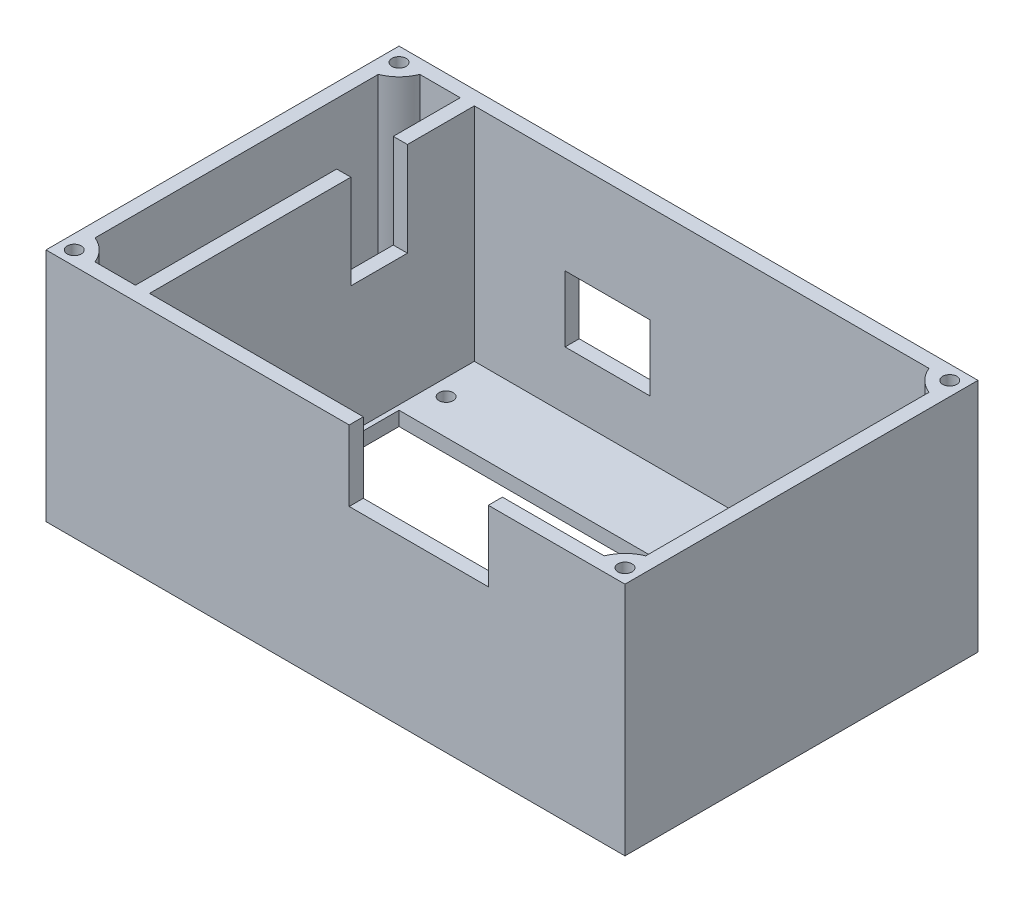
from build123d import *

# Parameters (mm, degrees)
SKETCH_1_R          = 1.5
EXTRUDE_1_DEPTH     = 3
SKETCH_2_W          = 123
SKETCH_2_H          = 75
EXTRUDE_2_DEPTH     = 47
SKETCH_3_W          = 6.652297382
SKETCH_3_H          = 12.01949186
CUT_EXTRUDE_1_DEPTH = 20
EXTRUDE_3_DEPTH     = 47
SKETCH_5_R          = 1.5
CUT_EXTRUDE_2_DEPTH = 10
SKETCH_7_W          = 4
SKETCH_7_H          = 24
EXTRUDE_4_DEPTH     = 8
SKETCH_8_W          = 4
SKETCH_8_H          = 24
EXTRUDE_5_DEPTH     = 10
SKETCH_9_W          = 14
SKETCH_9_H          = 4
EXTRUDE_6_DEPTH     = 8
SKETCH_10_W         = 29.551054495
SKETCH_10_H         = 15
CUT_EXTRUDE_3_DEPTH = 10
SKETCH_11_W         = 18
SKETCH_11_H         = 14
CUT_EXTRUDE_4_DEPTH = 10


with BuildPart() as part:
    # Эскиз1 → Бобышка-Вытянуть1 (new body)
    with BuildSketch(Plane(origin=(0, 0, 0), x_dir=(1, 0, 0), z_dir=(0, 1, 0))):
        Polygon((54, -3.949274275), (54, 40), (-69, 40), (-69, -35), (54, -35), align=None)
        with Locations(Location((-46.5, 27.5, 0), (0, 0, 270))):
            Circle(SKETCH_1_R, mode=Mode.SUBTRACT)
        with Locations(Location((-46.5, -27.5, 0), (0, 0, 270))):
            Circle(SKETCH_1_R, mode=Mode.SUBTRACT)
        with Locations(Location((46.5, 27.5, 0), (0, 0, 270))):
            Circle(SKETCH_1_R, mode=Mode.SUBTRACT)
        with Locations(Location((46.5, -27.5, 0), (0, 0, 270))):
            Circle(SKETCH_1_R, mode=Mode.SUBTRACT)
        Polygon((-49, 20), (-49, -20), (0, -20), (49, -20), (49, 20), (0, 20), align=None, mode=Mode.SUBTRACT)
    extrude(amount=EXTRUDE_1_DEPTH)

    # Эскиз2 → Бобышка-Вытянуть2 (add)
    with BuildSketch(Plane(origin=(0, 3, 0), x_dir=(1, 0, 0), z_dir=(0, 1, 0))):
        with Locations((-7.5, 2.5)):
            Rectangle(SKETCH_2_W, SKETCH_2_H)
        Polygon((-50, -32), (51, -32), (51, 37), (-50, 37), (-50, 0), align=None, mode=Mode.SUBTRACT)
        Polygon((-66, 37), (-53, 37), (-53, 0), (-53, -32), (-66, -32), align=None, mode=Mode.SUBTRACT)
    extrude(amount=EXTRUDE_2_DEPTH)

    # Эскиз3 → Вырез-Вытянуть1 (cut)
    with BuildSketch(Plane(origin=(0, 50, 0), x_dir=(1, 0, 0), z_dir=(0, 1, 0))):
        with Locations((-51.818044752, 16.773138265)):
            Rectangle(SKETCH_3_W, SKETCH_3_H)
    extrude(amount=-CUT_EXTRUDE_1_DEPTH, mode=Mode.SUBTRACT)

    # Эскиз4 → Бобышка-Вытянуть3 (add)
    with BuildSketch(Plane(origin=(0, 50, 0), x_dir=(1, 0, 0), z_dir=(0, 1, 0))):
        with BuildLine():
            Line((-69, 32), (-69, 40))
            Line((-69, 40), (-61, 40))
            ThreePointArc((-61, 40), (-63.343145751, 34.343145751), (-69, 32))
        make_face()
        with BuildLine():
            Line((46, 40), (54, 40))
            Line((54, 40), (54, 32))
            ThreePointArc((54, 32), (48.343145751, 34.343145751), (46, 40))
        make_face()
        with BuildLine():
            Line((-69, -27), (-69, -35))
            Line((-69, -35), (-61, -35))
            ThreePointArc((-61, -35), (-63.343145751, -29.343145751), (-69, -27))
        make_face()
        with BuildLine():
            Line((54, -27), (54, -35))
            Line((54, -35), (46, -35))
            ThreePointArc((46, -35), (48.343145751, -29.343145751), (54, -27))
        make_face()
    extrude(amount=-EXTRUDE_3_DEPTH)

    # Эскиз5 → Вырез-Вытянуть2 (cut)
    with BuildSketch(Plane(origin=(0, 50, 0), x_dir=(1, 0, 0), z_dir=(0, 1, 0))):
        with Locations(Location((-66, 37, 0), (0, 0, 270))):
            Circle(SKETCH_5_R)
        with Locations(Location((-66, -32, 0), (0, 0, 270))):
            Circle(SKETCH_5_R)
        with Locations(Location((51, -32, 0), (0, 0, 270))):
            Circle(SKETCH_5_R)
        with Locations(Location((51, 37, 0), (0, 0, 270))):
            Circle(SKETCH_5_R)
    extrude(amount=-CUT_EXTRUDE_2_DEPTH, mode=Mode.SUBTRACT)

    # Эскиз7 → Бобышка-Вытянуть4 (add)
    with BuildSketch(Plane.ZY.offset(69)):
        with Locations((-14, 25)):
            Rectangle(SKETCH_7_W, SKETCH_7_H)
    extrude(amount=EXTRUDE_4_DEPTH)

    # Эскиз8 → Бобышка-Вытянуть5 (add)
    with BuildSketch(Plane(origin=(0, 0, -16), x_dir=(-1, 0, 0), z_dir=(0, 0, -1))):
        with Locations((75, 25)):
            Rectangle(SKETCH_8_W, SKETCH_8_H)
    extrude(amount=EXTRUDE_5_DEPTH)

    # Эскиз9 → Бобышка-Вытянуть6 (add)
    with BuildSketch(Plane.ZY.offset(69)):
        with Locations((-19, 39)):
            Rectangle(SKETCH_9_W, SKETCH_9_H)
        with Locations((-19, 11)):
            Rectangle(SKETCH_9_W, SKETCH_9_H)
    extrude(amount=EXTRUDE_6_DEPTH)

    # Эскиз10 → Вырез-Вытянуть3 (cut)
    with BuildSketch(Plane.XY.offset(35)):
        with Locations((10.188847336, 42.5)):
            Rectangle(SKETCH_10_W, SKETCH_10_H)
    extrude(amount=-CUT_EXTRUDE_3_DEPTH, mode=Mode.SUBTRACT)

    # Эскиз11 → Вырез-Вытянуть4 (cut)
    with BuildSketch(Plane(origin=(0, 0, -40), x_dir=(-1, 0, 0), z_dir=(0, 0, -1))):
        with Locations((21.719997663, 22.286107602)):
            Rectangle(SKETCH_11_W, SKETCH_11_H)
    extrude(amount=-CUT_EXTRUDE_4_DEPTH, mode=Mode.SUBTRACT)


solid = part.part
